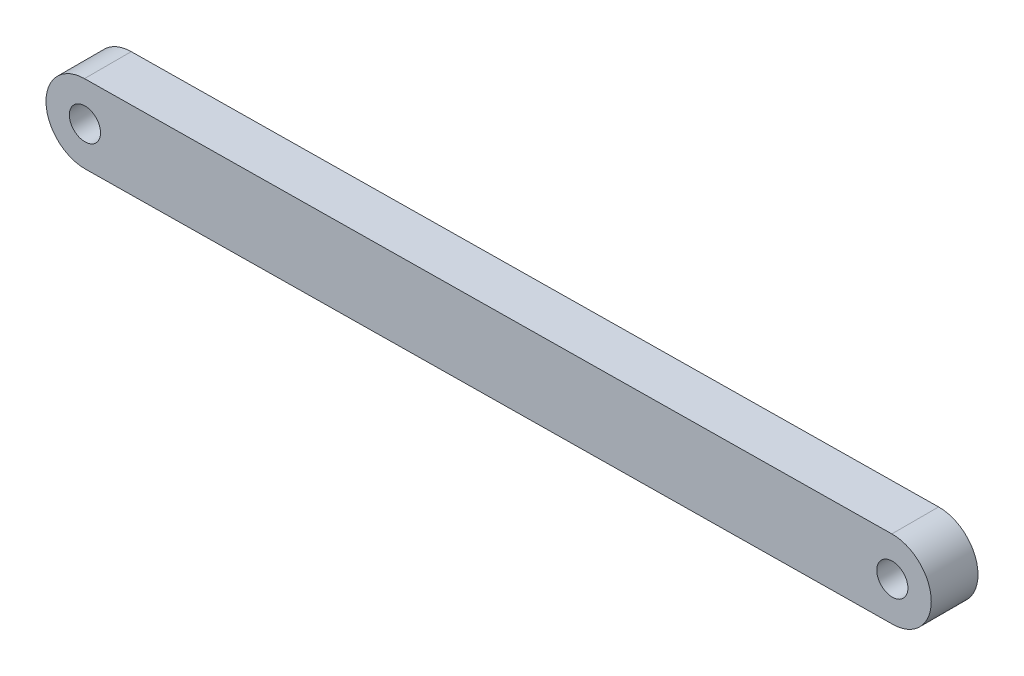
from build123d import *

# Parameters (mm, degrees)
BOSS_EXTRUDE1_DEPTH = 3
SKETCH2_R           = 1
CUT_EXTRUDE1_DEPTH  = 35.365105642


with BuildPart() as part:
    # Sketch1 → Boss-Extrude1 (new body)
    with BuildSketch(Plane.XY):
        with BuildLine():
            Line((-20.256048223, 1.897205969), (31.563951777, 2.499830969))
            ThreePointArc((31.563951777, 2.499830969), (34.092853773, 0.029071027), (31.622093831, -2.499830969))
            Line((31.622093831, -2.499830969), (-20.197906169, -3.102455969))
            ThreePointArc((-20.197906169, -3.102455969), (-22.726808165, -0.631696027), (-20.256048223, 1.897205969))
        make_face()
    extrude(amount=BOSS_EXTRUDE1_DEPTH)

    # Sketch2 → Cut-Extrude1 (cut, through all)
    with BuildSketch(Plane.XY.offset(3)):
        with Locations((31.593022804, 0)):
            Circle(SKETCH2_R)
        with Locations((-20.226977196, -0.602625)):
            Circle(SKETCH2_R)
    extrude(amount=-CUT_EXTRUDE1_DEPTH, mode=Mode.SUBTRACT)


solid = part.part
